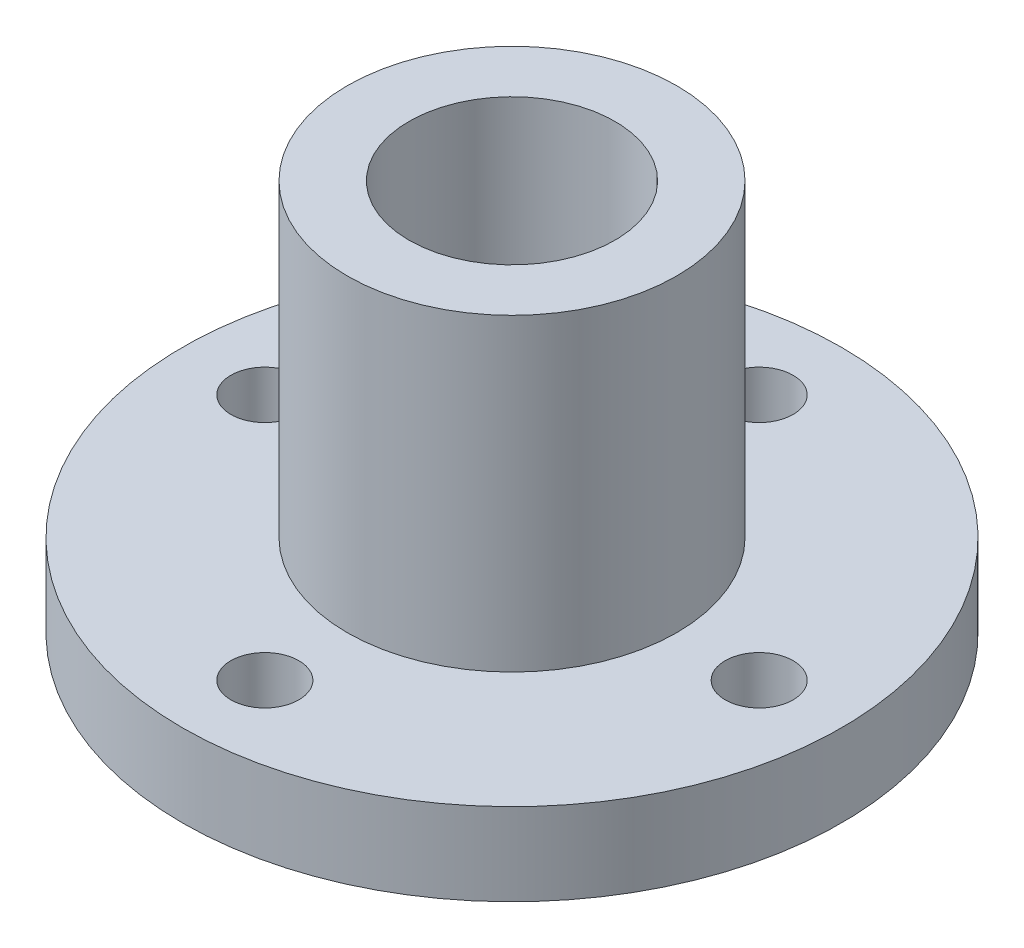
from build123d import *

# Parameters (mm, degrees)
SKETCH_1_R          = 8
SKETCH_1_R_2        = 5
EXTRUDE_3_DEPTH     = 19
SKETCH_6_R          = 16
SKETCH_6_R_2        = 1.65
EXTRUDE_4_DEPTH     = 4
CUT_EXTRUDE_START   = -4
SKETCH_7_R          = 5
CUT_EXTRUDE_3_DEPTH = 4


with BuildPart() as part:
    # 草图1 → 凸台-拉伸3 (new body)
    with BuildSketch(Plane(origin=(0, 0, 0), x_dir=(1, 0, 0), z_dir=(0, 1, 0))):
        with Locations(Location((0, 0, 0), (0, 0, 270))):
            Circle(SKETCH_1_R)
        with Locations(Location((0, 0, 0), (0, 0, 270))):
            Circle(SKETCH_1_R_2, mode=Mode.SUBTRACT)
    extrude(amount=EXTRUDE_3_DEPTH)

    # 草图6 → 凸台-拉伸4 (add)
    with BuildSketch(Plane.XZ):
        with Locations(Location((0, 0, 0), (0, 0, 270))):
            Circle(SKETCH_6_R)
        with Locations(Location((-12, 0, 0), (0, 0, 270))):
            Circle(SKETCH_6_R_2, mode=Mode.SUBTRACT)
        with Locations(Location((0, 12, 0), (0, 0, 270))):
            Circle(SKETCH_6_R_2, mode=Mode.SUBTRACT)
        with Locations(Location((12, 0, 0), (0, 0, 270))):
            Circle(SKETCH_6_R_2, mode=Mode.SUBTRACT)
        with Locations(Location((0, -12, 0), (0, 0, 270))):
            Circle(SKETCH_6_R_2, mode=Mode.SUBTRACT)
    extrude(amount=-EXTRUDE_4_DEPTH)

    # 草图7 → 切除-拉伸3 (cut)
    with BuildSketch(Plane(origin=(0, 4, 0), x_dir=(1, 0, 0), z_dir=(0, 1, 0)).offset(CUT_EXTRUDE_START)):
        with Locations(Location((0, 0, 0), (0, 0, 270))):
            Circle(SKETCH_7_R)
    extrude(amount=CUT_EXTRUDE_3_DEPTH, mode=Mode.SUBTRACT)


solid = part.part
